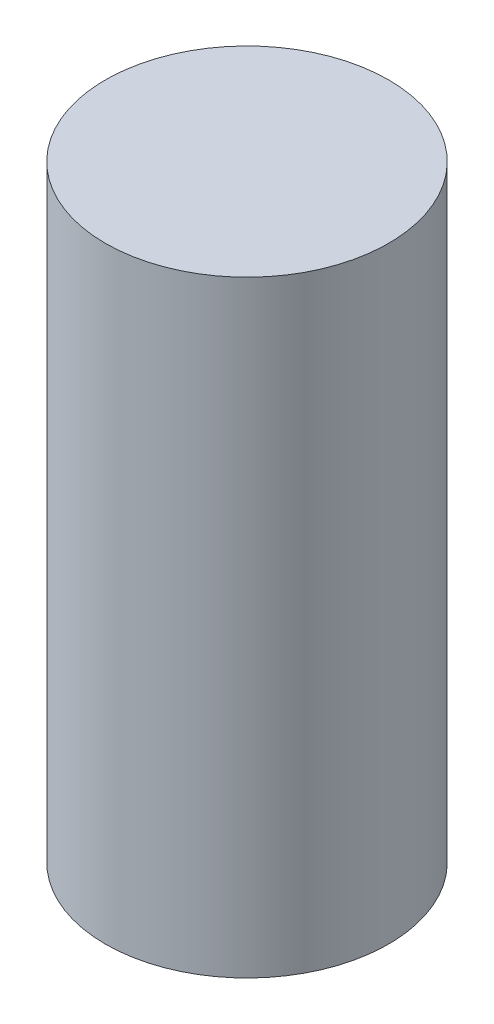
from build123d import *

# Parameters (mm, degrees)
SKETCH1_R           = 3.5
BOSS_EXTRUDE1_DEPTH = 15


with BuildPart() as part:
    # Sketch1 → Boss-Extrude1 (new body)
    with BuildSketch(Plane(origin=(0, 0, 0), x_dir=(1, 0, 0), z_dir=(0, 1, 0))):
        with Locations(Location((0, 0, 0), (0, 0, 270))):
            Circle(SKETCH1_R)
    extrude(amount=BOSS_EXTRUDE1_DEPTH)


solid = part.part
